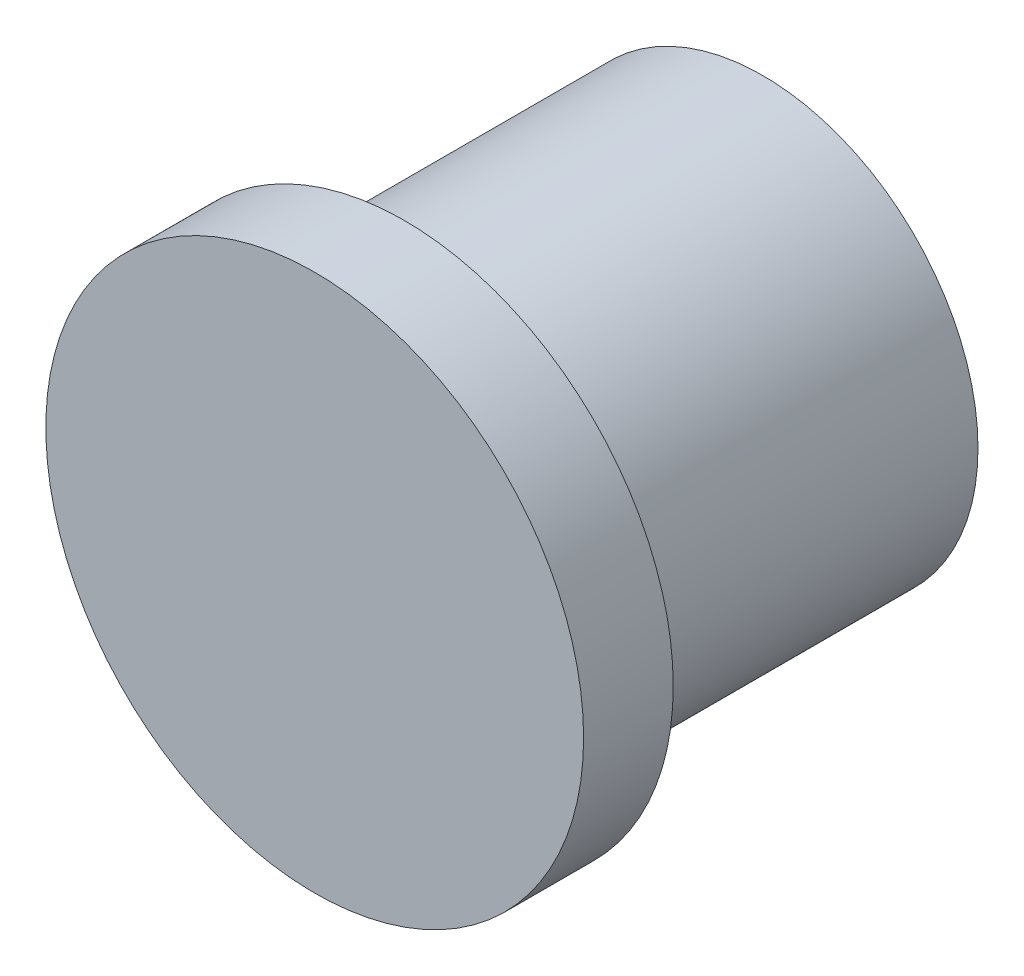
from build123d import *

# Parameters (mm, degrees)
SKETCH1_R           = 15
SKETCH1_R_2         = 12
BOSS_EXTRUDE1_DEPTH = 5
BOSS_EXTRUDE2_START = -25
SKETCH2_R           = 12
BOSS_EXTRUDE2_DEPTH = 25


with BuildPart() as part:
    # Sketch1 → Boss-Extrude1 (new body)
    with BuildSketch(Plane.XY):
        Circle(SKETCH1_R)
        Circle(SKETCH1_R_2, mode=Mode.SUBTRACT)
    extrude(amount=BOSS_EXTRUDE1_DEPTH)

    # Sketch2 → Boss-Extrude2 (add)
    with BuildSketch(Plane.XY.offset(5).offset(BOSS_EXTRUDE2_START)):
        Circle(SKETCH2_R)
    extrude(amount=BOSS_EXTRUDE2_DEPTH)


solid = part.part
